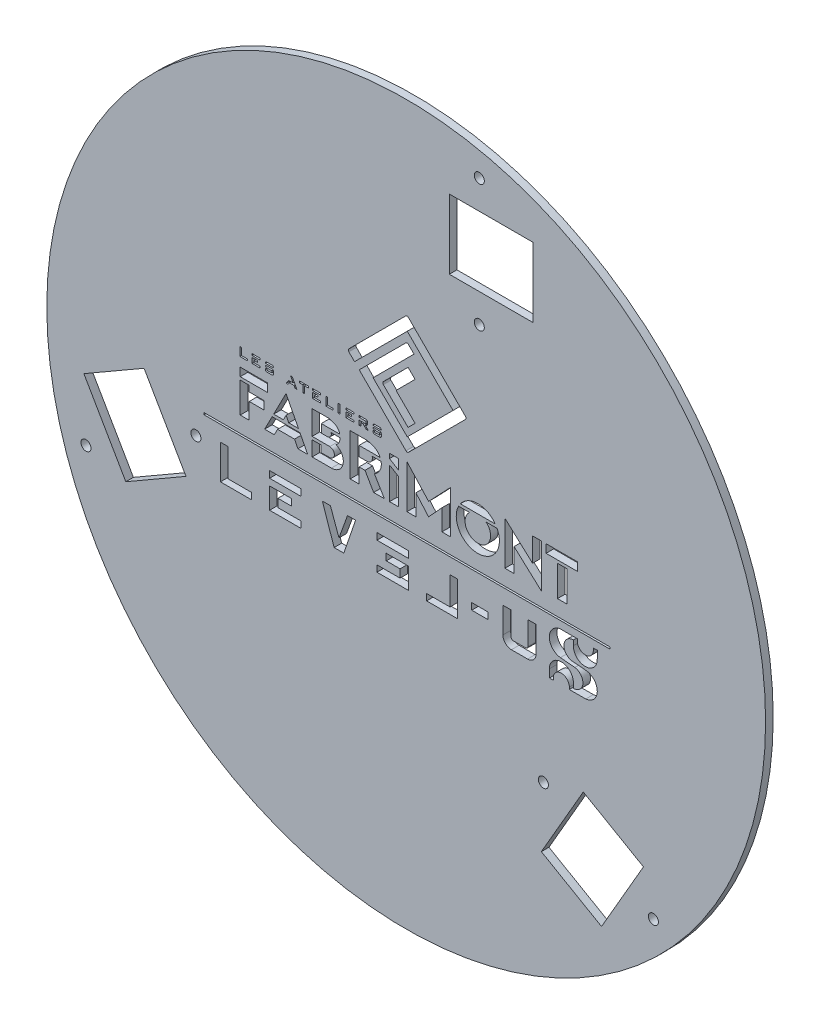
from build123d import *

# Parameters (mm, degrees)
ESQUISSE1_R        = 150
ESQUISSE1_W        = 6.731645007
ESQUISSE1_H        = 2.75786913
ESQUISSE1_W_2      = 13.090950033
ESQUISSE1_H_2      = 2.784768482
ESQUISSE1_H_3      = 2.767765773
ESQUISSE1_W_3      = 3.272737503
ESQUISSE1_H_4      = 0.69619212
ESQUISSE1_W_4      = 0.68603907
ESQUISSE1_H_5      = 3.588641098
ESQUISSE1_W_5      = 3.272737508
ESQUISSE1_W_6      = 169.389789257
ESQUISSE1_H_6      = 0.798843188
ESQUISSE1_W_7      = 3.919515326
ESQUISSE1_H_7      = 12.781823865
ESQUISSE1_W_8      = 13.187154377
ESQUISSE1_H_8      = 3.483743869
ESQUISSE1_W_9      = 35
ESQUISSE1_H_9      = 29.000000001
ESQUISSE1_W_10     = 11.390112932
BOSS_EXTRU_1_DEPTH = 3.175


with BuildPart() as part:
    # Esquisse1 → Boss.-Extru.1 (new body)
    with BuildSketch(Plane.XY):
        with Locations((61.36797308, 63.927277379)):
            Circle(ESQUISSE1_R)
        with BuildLine():
            Line((39.802839293, 108.269167166), (61.81799605, 130.287151309))
            Line((61.81799605, 130.287151309), (80.91486918, 111.192730463))
            Line((80.91486918, 111.192730463), (61.81799605, 92.093404735))
            Line((61.81799605, 92.093404735), (47.562765531, 106.346804707))
            Line((47.562765531, 106.346804707), (64.625312717, 123.411543226))
            Line((64.625312717, 123.411543226), (62.280325644, 125.756229172))
            ThreePointArc((62.280325644, 125.756229172), (61.741495947, 125.979379207), (61.202694911, 125.756159977))
            Line((61.202694911, 125.756159977), (41.760644867, 106.311613001))
            Line((41.760644867, 106.311613001), (61.279146092, 86.795618198))
            ThreePointArc((61.279146092, 86.795618198), (61.817975789, 86.572468163), (62.356776825, 86.795687393))
            Line((62.356776825, 86.795687393), (86.117475765, 110.559437904))
            ThreePointArc((86.117475765, 110.559437904), (86.3406258, 111.098267601), (86.11740657, 111.637068637))
            Line((86.11740657, 111.637068637), (62.256010971, 135.495400128))
            ThreePointArc((62.256010971, 135.495400128), (61.717181274, 135.718550163), (61.178380238, 135.495330933))
            Line((61.178380238, 135.495330933), (37.4176813, 111.731580422))
            ThreePointArc((37.4176813, 111.731580422), (37.194531265, 111.192750725), (37.417750495, 110.653949689))
            Line((37.417750495, 110.653949689), (39.802839293, 108.269167166))
        make_face(mode=Mode.SUBTRACT)
        with Locations((92.073197029, 44.27738818)):
            Rectangle(ESQUISSE1_W, ESQUISSE1_H, mode=Mode.SUBTRACT)
        Polygon((69.901655778, 36.855773092), (69.901655778, 39.537154958), (79.656520536, 39.537154958), (79.656520536, 51.210337484), (82.771025539, 51.210337484), (82.771025539, 36.855773092), align=None, mode=Mode.SUBTRACT)
        with Locations((55.695543851, 49.817953243)):
            Rectangle(ESQUISSE1_W_2, ESQUISSE1_H_2, mode=Mode.SUBTRACT)
        with Locations((10.917026814, 49.809451889)):
            Rectangle(ESQUISSE1_W_2, ESQUISSE1_H_3, mode=Mode.SUBTRACT)
        Polygon((4.371551797, 36.855773092), (17.46250183, 36.855773092), (17.46250183, 39.529083204), (7.814510337, 39.529083204), (7.814510337, 42.898453615), (13.576494708, 42.898453615), (13.576494708, 45.656322745), (4.371551797, 45.656322745), align=None, mode=Mode.SUBTRACT)
        with BuildLine():
            Line((48.211767281, 89.823698357), (50.304602867, 89.823698357))
            ThreePointArc((50.304602867, 89.823698357), (50.789536698, 89.622832188), (50.990402867, 89.137898357))
            Line((50.990402867, 89.137898357), (50.990402867, 89.127506237))
            Line((50.990402867, 89.127506237), (47.525967281, 89.127506237))
            Line((47.525967281, 89.127506237), (47.525967281, 89.137898357))
            ThreePointArc((47.525967281, 89.137898357), (47.726833451, 89.622832188), (48.211767281, 89.823698357))
        make_face(mode=Mode.SUBTRACT)
        with Locations((37.887114092, 89.475602297)):
            Rectangle(ESQUISSE1_W_3, ESQUISSE1_H_4, mode=Mode.SUBTRACT)
        Polygon((27.796169423, 86.235057259), (30.900653633, 86.235057259), (30.900653633, 86.905402726), (28.47527121, 86.905402726), (28.47527121, 89.823698357), (27.796169423, 89.823698357), align=None, mode=Mode.SUBTRACT)
        with Locations((33.301790388, 88.029377808)):
            Rectangle(ESQUISSE1_W_4, ESQUISSE1_H_5, mode=Mode.SUBTRACT)
        Polygon((24.567229374, 88.435194673), (24.567229374, 87.74572739), (23.126733276, 87.74572739), (23.126733276, 86.905402726), (25.538731149, 86.905402726), (25.538731149, 86.235057259), (22.265993646, 86.235057259), (22.265993646, 88.435194673), align=None, mode=Mode.SUBTRACT)
        with Locations((23.902362397, 89.475602297)):
            Rectangle(ESQUISSE1_W_3, ESQUISSE1_H_4, mode=Mode.SUBTRACT)
        Polygon((-2.063598746, 87.74572739), (-0.623102654, 87.74572739), (-0.623102654, 88.435194673), (-2.924338381, 88.435194673), (-2.924338381, 86.235057259), (0.348399127, 86.235057259), (0.348399127, 86.903384787), (-2.063598746, 86.903384787), align=None, mode=Mode.SUBTRACT)
        with Locations((-1.287969627, 89.475602297)):
            Rectangle(ESQUISSE1_W_5, ESQUISSE1_H_4, mode=Mode.SUBTRACT)
        with BuildLine():
            Line((62.1431773, 95.688579322), (51.821807028, 105.99122113))
            ThreePointArc((51.821807028, 105.99122113), (51.598133194, 106.529833604), (51.820828443, 107.068851421))
            Line((51.820828443, 107.068851421), (62.152684002, 117.41948855))
            Line((62.152684002, 117.41948855), (65.072494185, 114.504976452))
            Line((65.072494185, 114.504976452), (57.143290201, 106.561358512))
            Line((57.143290201, 106.561358512), (65.077465747, 98.628201815))
            Line((65.077465747, 98.628201815), (62.1431773, 95.688579322))
        make_face(mode=Mode.SUBTRACT)
        with BuildLine():
            Line((3.262887837, 86.235057259), (5.355723423, 86.235057259))
            ThreePointArc((5.355723423, 86.235057259), (5.840657253, 86.435923429), (6.041523423, 86.920857259))
            Line((6.041523423, 86.920857259), (6.041523423, 87.749394673))
            ThreePointArc((6.041523423, 87.749394673), (5.840657253, 88.234328503), (5.355723423, 88.435194673))
            Line((5.355723423, 88.435194673), (2.577087837, 88.435194673))
            Line((2.577087837, 88.435194673), (2.577087837, 88.43152739))
            ThreePointArc((2.577087837, 88.43152739), (2.777954007, 87.94659356), (3.262887837, 87.74572739))
            Line((3.262887837, 87.74572739), (5.355723423, 87.74572739))
            Line((5.355723423, 87.74572739), (5.355723423, 86.903384787))
            Line((5.355723423, 86.903384787), (3.265274203, 86.903384787))
            Line((3.265274203, 86.903384787), (3.265274203, 87.335125966))
            Line((3.265274203, 87.335125966), (2.577087837, 87.335125966))
            Line((2.577087837, 87.335125966), (2.577087837, 86.920857259))
            ThreePointArc((2.577087837, 86.920857259), (2.777954007, 86.435923429), (3.262887837, 86.235057259))
        make_face(mode=Mode.SUBTRACT)
        Polygon((20.555865077, 89.823698357), (20.555865077, 89.127506237), (18.976351066, 89.127506237), (18.976351066, 86.235057259), (18.299416489, 86.235057259), (18.299416489, 89.127506237), (16.75213746, 89.127506237), (16.75213746, 89.823698357), align=None, mode=Mode.SUBTRACT)
        Polygon((54.413662345, 80.560288355), (58.180772499, 78.240299787), (58.180772499, 82.461845497), (54.413662345, 82.461845497), align=None, mode=Mode.SUBTRACT)
        Polygon((65.419897925, 73.69954547), (65.419897925, 64.985615003), (61.688677848, 64.985615003), (61.688677848, 83.085586418), (70.71969971, 73.233223817), (79.887417285, 82.861342833), (79.887417285, 64.985615003), (76.26725655, 64.985615003), (76.26725655, 73.69954547), (70.711083949, 67.630728093), align=None, mode=Mode.SUBTRACT)
        with BuildLine():
            Line((94.70698494, 77.767438868), (99.306437795, 77.76743887))
            ThreePointArc((99.306437795, 77.76743887), (91.264316644, 64.687139066), (83.222195495, 77.767438871))
            Line((83.222195495, 77.767438871), (87.821648353, 77.767438871))
            ThreePointArc((87.821648353, 77.767438871), (91.264316642, 68.370406553), (94.70698494, 77.767438868))
        make_face(mode=Mode.SUBTRACT)
        with Locations((61.688677848, 58.078374284)):
            Rectangle(ESQUISSE1_W_6, ESQUISSE1_H_6, mode=Mode.SUBTRACT)
        with Locations((126.463931221, 71.376526936)):
            Rectangle(ESQUISSE1_W_7, ESQUISSE1_H_7, mode=Mode.SUBTRACT)
        with Locations((126.335722776, 80.719973563)):
            Rectangle(ESQUISSE1_W_8, ESQUISSE1_H_8, mode=Mode.SUBTRACT)
        Polygon((11.226870065, 82.461845497), (16.408068461, 72.429139451), (12.352859213, 72.429139451), (11.226870065, 74.609468649), (10.102676794, 72.429139451), (6.053935346, 72.429139451), align=None, mode=Mode.SUBTRACT)
        Polygon((2.015702569, 71.911784275), (-4.161148262, 71.911784275), (-4.161148262, 65.118728722), (-7.916673568, 65.118728722), (-7.916673568, 77.767438868), (-4.161148262, 77.767438868), (-4.161148262, 75.346113337), (2.015702569, 75.346113337), align=None, mode=Mode.SUBTRACT)
        with BuildLine():
            Line((47.525967281, 88.435194673), (50.304602867, 88.435194673))
            ThreePointArc((50.304602867, 88.435194673), (50.789536698, 88.234328503), (50.990402867, 87.749394673))
            Line((50.990402867, 87.749394673), (50.990402867, 86.920857259))
            ThreePointArc((50.990402867, 86.920857259), (50.789536698, 86.435923429), (50.304602867, 86.235057259))
            Line((50.304602867, 86.235057259), (48.211767281, 86.235057259))
            ThreePointArc((48.211767281, 86.235057259), (47.726833451, 86.435923429), (47.525967281, 86.920857259))
            Line((47.525967281, 86.920857259), (47.525967281, 87.335125966))
            Line((47.525967281, 87.335125966), (48.214153647, 87.335125966))
            Line((48.214153647, 87.335125966), (48.214153647, 86.903384787))
            Line((48.214153647, 86.903384787), (50.304602867, 86.903384787))
            Line((50.304602867, 86.903384787), (50.304602867, 87.74572739))
            Line((50.304602867, 87.74572739), (48.211767281, 87.74572739))
            ThreePointArc((48.211767281, 87.74572739), (47.726833451, 87.94659356), (47.525967281, 88.43152739))
            Line((47.525967281, 88.43152739), (47.525967281, 88.435194673))
        make_face(mode=Mode.SUBTRACT)
        Polygon((2.284635488, 65.118728722), (6.333376936, 65.118728722), (7.699586767, 67.768439643), (14.75978814, 67.768439643), (16.196924489, 64.985615003), (20.252133737, 64.985615003), (17.042553267, 71.200543468), (5.420462501, 71.200543468), align=None, mode=Mode.SUBTRACT)
        with BuildLine():
            Line((25.931121817, 78.978151272), (33.679652067, 78.978151272))
            ThreePointArc((33.679652067, 78.978151272), (32.636361178, 80.836726211), (30.831013962, 81.969633142))
            Line((30.831013962, 81.969633142), (29.299421409, 82.461897174))
            Line((29.299421409, 82.461897174), (22.104939054, 82.461897174))
            Line((22.104939054, 82.461897174), (22.104939054, 72.429191128))
            Line((22.104939054, 72.429191128), (29.478101938, 72.429191128))
            ThreePointArc((29.478101938, 72.429191128), (31.381420303, 70.383845554), (29.382277758, 68.432054479))
            Line((29.382277758, 68.432054479), (25.903848357, 68.432054479))
            Line((25.903848357, 68.432054479), (25.903848357, 71.200593541))
            Line((25.903848357, 71.200593541), (22.10493854, 71.200593541))
            Line((22.10493854, 71.200593541), (22.10493854, 64.985665077))
            Line((22.10493854, 64.985665077), (30.150302927, 64.985665077))
            ThreePointArc((30.150302927, 64.985665077), (35.024826758, 68.891898978), (32.124130417, 74.424132396))
            ThreePointArc((32.124130417, 74.424132396), (33.357268206, 75.901267801), (33.826071418, 77.767488946))
            Line((33.826071418, 77.767488946), (30.031138101, 77.767488946))
            ThreePointArc((30.031138101, 77.767488946), (29.865542187, 76.314133341), (28.648760776, 75.50227897))
            Line((28.648760776, 75.50227897), (25.931121817, 75.50227897))
            Line((25.931121817, 75.50227897), (25.931121817, 78.978151272))
        make_face(mode=Mode.SUBTRACT)
        with BuildLine():
            Line((41.705376449, 78.978101628), (50.492445064, 78.978101628))
            ThreePointArc((50.492445064, 78.978101628), (49.130418898, 80.806383582), (47.135350374, 81.909756484))
            Line((47.135350374, 81.909756484), (45.197958272, 82.461845494))
            Line((45.197958272, 82.461845494), (37.979606095, 82.461845494))
            Line((37.979606095, 82.461845494), (37.979606095, 64.985615001))
            Line((37.979606095, 64.985615001), (41.705376443, 64.985615001))
            Line((41.705376443, 64.985615001), (41.705376443, 71.20054347))
            Line((41.705376443, 71.20054347), (44.172281433, 71.20054347))
            Line((44.172281433, 71.20054347), (47.779334986, 64.985615006))
            Line((47.779334986, 64.985615006), (52.244221108, 64.985615006))
            Line((52.244221108, 64.985615006), (48.067087332, 71.945483309))
            ThreePointArc((48.067087332, 71.945483309), (50.440954942, 74.389058751), (50.879786747, 77.767480723))
            Line((50.879786747, 77.767480723), (47.135350382, 77.767480723))
            ThreePointArc((47.135350382, 77.767480723), (46.830496996, 75.76709939), (45.029358803, 74.844948494))
            Line((45.029358803, 74.844948494), (41.705376449, 74.844948494))
            Line((41.705376449, 74.844948494), (41.705376449, 78.978101628))
        make_face(mode=Mode.SUBTRACT)
        Polygon((-73.14983017, 47.462515996), (-55.64983017, 17.151626863), (-30.53509346, 31.651626864), (-48.03509346, 61.962515996), align=None, mode=Mode.SUBTRACT)
        Polygon((135.271039621, 0.474712328), (117.77103962, -29.836176806), (142.88577633, -44.336176805), (160.38577633, -14.025287672), align=None, mode=Mode.SUBTRACT)
        with Locations((96.867973079, 174.155492946)):
            Rectangle(ESQUISSE1_W_9, ESQUISSE1_H_9, mode=Mode.SUBTRACT)
        Polygon((54.413662345, 64.985615003), (58.180772499, 64.985615003), (58.180772499, 75.943449648), (54.413662345, 78.240299787), align=None, mode=Mode.SUBTRACT)
        with Locations((-2.221617102, 80.719973563)):
            Rectangle(ESQUISSE1_W_10, ESQUISSE1_H_8, mode=Mode.SUBTRACT)
        Polygon((102.546069037, 64.985615003), (106.395567469, 64.985615003), (106.395567469, 74.748202671), (117.876321231, 64.274813621), (117.876321231, 82.461845497), (114.108016047, 82.461845497), (114.108016047, 72.557198641), (102.546069037, 83.085586418), align=None, mode=Mode.SUBTRACT)
        with BuildLine():
            Line((83.959502194, 78.978101631), (98.569131095, 78.978101631))
            ThreePointArc((98.569131095, 78.978101631), (91.264316645, 82.711951882), (83.959502194, 78.978101631))
        make_face(mode=Mode.SUBTRACT)
        Polygon((14.534774041, 87.06405329), (14.95965948, 86.235057259), (15.748291614, 86.235057259), (13.805346508, 89.823698357), (13.120372811, 89.823698357), (14.185395527, 87.74572739), (12.281449515, 87.74572739), (11.342159502, 86.235057259), (12.077748069, 86.235057259), (12.562837741, 87.06405329), align=None, mode=Mode.SUBTRACT)
        with BuildLine():
            Line((3.262887838, 89.823698359), (5.355723424, 89.823698359))
            ThreePointArc((5.355723424, 89.823698359), (5.844368724, 89.619172045), (6.041523423, 89.127506237))
            Line((6.041523423, 89.127506237), (2.577087838, 89.127506237))
            Line((2.577087838, 89.127506237), (2.577087838, 89.137898359))
            ThreePointArc((2.577087838, 89.137898359), (2.777954008, 89.622832189), (3.262887838, 89.823698359))
        make_face(mode=Mode.SUBTRACT)
        Polygon((-7.278213798, 89.823698357), (-8.056840049, 89.823698357), (-8.056840049, 86.235057259), (-4.839497609, 86.235057259), (-4.839497609, 86.905402726), (-7.278213798, 86.905402726), align=None, mode=Mode.SUBTRACT)
        Polygon((36.250745341, 86.235057259), (39.523482844, 86.235057259), (39.523482844, 86.905402726), (37.111484971, 86.905402726), (37.111484971, 87.74572739), (38.551981069, 87.74572739), (38.551981069, 88.435194673), (36.250745341, 88.435194673), align=None, mode=Mode.SUBTRACT)
        with BuildLine():
            Line((45.174159371, 89.137898357), (45.174159371, 88.268809996))
            ThreePointArc((45.174159371, 88.268809996), (44.973293202, 87.783876166), (44.488359371, 87.583009996))
            Line((44.488359371, 87.583009996), (44.201145239, 87.583009996))
            Line((44.201145239, 87.583009996), (45.608703526, 86.235057259))
            Line((45.608703526, 86.235057259), (44.664190191, 86.235057259))
            Line((44.664190191, 86.235057259), (43.363074891, 87.573372104))
            Line((43.363074891, 87.573372104), (42.563129922, 87.573372104))
            Line((42.563129922, 87.573372104), (42.563129922, 86.235057259))
            Line((42.563129922, 86.235057259), (41.767526154, 86.235057259))
            Line((41.767526154, 86.235057259), (41.767526154, 88.103456113))
            Line((41.767526154, 88.103456113), (44.509983936, 88.103456113))
            Line((44.509983936, 88.103456113), (44.509983936, 89.127506237))
            Line((44.509983936, 89.127506237), (41.767526154, 89.127506237))
            Line((41.767526154, 89.127506237), (41.767526154, 89.823698357))
            Line((41.767526154, 89.823698357), (44.488359371, 89.823698357))
            ThreePointArc((44.488359371, 89.823698357), (44.973293202, 89.622832188), (45.174159371, 89.137898357))
        make_face(mode=Mode.SUBTRACT)
        Polygon((31.281701538, 36.838770383), (35.330554146, 36.838770383), (40.234999013, 51.193334775), (36.874430896, 51.193334775), (33.306127842, 41.323760026), (29.737824788, 51.193334775), (26.37725667, 51.193334775), align=None, mode=Mode.SUBTRACT)
        Polygon((-3.289085114, 39.537154958), (-13.043949872, 39.537154958), (-13.043949872, 51.210337484), (-16.158454875, 51.210337484), (-16.158454875, 36.855773092), (-3.289085114, 36.855773092), align=None, mode=Mode.SUBTRACT)
        Polygon((49.150068834, 39.529083204), (49.150068834, 36.855773092), (62.241018867, 36.855773092), (62.241018867, 45.656322745), (53.036075956, 45.656322745), (53.036075956, 42.898453615), (58.798060328, 42.898453615), (58.798060328, 39.529083204), align=None, mode=Mode.SUBTRACT)
        with BuildLine():
            Line((115.579630549, 40.467394149), (115.579630549, 51.210337484))
            Line((115.579630549, 51.210337484), (112.219062431, 51.210337484))
            Line((112.219062431, 51.210337484), (112.219062431, 41.537383475))
            ThreePointArc((112.219062431, 41.537383475), (111.921482921, 40.818962985), (111.203062431, 40.521383475))
            Line((111.203062431, 40.521383475), (106.098456324, 40.521383475))
            ThreePointArc((106.098456324, 40.521383475), (105.380035834, 40.818962985), (105.082456324, 41.537383475))
            Line((105.082456324, 41.537383475), (105.082456324, 51.210337484))
            Line((105.082456324, 51.210337484), (101.721888206, 51.210337484))
            Line((101.721888206, 51.210337484), (101.721888206, 40.467394149))
            ThreePointArc((101.721888206, 40.467394149), (102.763416492, 37.952922435), (105.277888206, 36.911394149))
            Line((105.277888206, 36.911394149), (112.023630549, 36.911394149))
            ThreePointArc((112.023630549, 36.911394149), (114.538102263, 37.952922435), (115.579630549, 40.467394149))
        make_face(mode=Mode.SUBTRACT)
        with BuildLine():
            Line((121.148867386, 34.608724612), (121.119708298, 37.924508877))
            ThreePointArc((121.119708298, 37.924508877), (126.134593438, 42.93939402), (131.149478579, 37.924508877))
            Line((131.149478579, 37.924508877), (131.126267543, 35.875092186))
            ThreePointArc((131.126267543, 35.875092186), (135.114339451, 39.50974119), (131.754835867, 43.732196233))
            Line((131.754835867, 43.732196233), (125.699924923, 44.267244624))
            ThreePointArc((125.699924923, 44.267244624), (121.091960122, 49.446062696), (125.699924924, 54.624880767))
            Line((125.699924924, 54.624880767), (132.775339521, 54.624880767))
            Line((132.775339521, 54.624880767), (132.775339521, 53.784001077))
            ThreePointArc((132.775339521, 53.784001077), (136.117321809, 50.442018788), (139.459304098, 53.784001077))
            Line((139.459304098, 53.784001077), (139.459304098, 54.624880767))
            Line((139.459304098, 54.624880767), (141.149095415, 54.624880767))
            Line((141.149095415, 54.624880767), (141.099370881, 51.248444207))
            ThreePointArc((141.099370881, 51.248444207), (136.107925294, 46.256998614), (131.116479704, 51.248444205))
            Line((131.116479704, 51.248444205), (131.126267541, 53.364207604))
            ThreePointArc((131.126267541, 53.364207604), (127.221743897, 49.668005516), (130.557467657, 45.451352606))
            Line((130.557467657, 45.451352606), (136.117321805, 45.007706412))
            ThreePointArc((136.117321805, 45.007706412), (141.112105155, 39.899757613), (136.311691482, 34.608724612))
            Line((136.311691482, 34.608724612), (129.460403498, 34.608724612))
            Line((129.460403498, 34.608724612), (129.460403498, 35.471151762))
            ThreePointArc((129.460403498, 35.471151762), (126.10933113, 38.82222413), (122.758258762, 35.471151762))
            Line((122.758258762, 35.471151762), (122.758258762, 34.608724612))
            Line((122.758258762, 34.608724612), (121.148867386, 34.608724612))
        make_face(mode=Mode.SUBTRACT)
        with BuildLine():
            ThreePointArc((-24.292788615, 48.476944411), (-26.392788615, 50.576944411), (-28.492788615, 48.476944411))
            ThreePointArc((-28.492788615, 48.476944411), (-26.392788615, 46.376944411), (-24.292788615, 48.476944411))
        make_face(mode=Mode.SUBTRACT)
        with BuildLine():
            ThreePointArc((-70.192135015, 21.976944412), (-72.292135015, 24.076944412), (-74.392135015, 21.976944412))
            ThreePointArc((-74.392135015, 21.976944412), (-72.292135015, 19.876944412), (-70.192135015, 21.976944412))
        make_face(mode=Mode.SUBTRACT)
        with BuildLine():
            ThreePointArc((120.728734773, -4.350605219), (118.628734773, -2.250605219), (116.528734773, -4.350605219))
            ThreePointArc((116.528734773, -4.350605219), (118.628734773, -6.450605219), (120.728734773, -4.350605219))
        make_face(mode=Mode.SUBTRACT)
        with BuildLine():
            ThreePointArc((166.628081173, -30.850605219), (164.528081173, -28.750605219), (162.428081173, -30.850605219))
            ThreePointArc((162.428081173, -30.850605219), (164.528081173, -32.950605219), (166.628081173, -30.850605219))
        make_face(mode=Mode.SUBTRACT)
        with BuildLine():
            ThreePointArc((89.76797308, 147.655492945), (91.86797308, 145.555492945), (93.96797308, 147.655492945))
            ThreePointArc((93.96797308, 147.655492945), (91.86797308, 149.755492945), (89.76797308, 147.655492945))
        make_face(mode=Mode.SUBTRACT)
        with BuildLine():
            ThreePointArc((93.96797308, 200.655492947), (91.86797308, 202.755492947), (89.76797308, 200.655492947))
            ThreePointArc((89.76797308, 200.655492947), (91.86797308, 198.555492947), (93.96797308, 200.655492947))
        make_face(mode=Mode.SUBTRACT)
    extrude(amount=BOSS_EXTRU_1_DEPTH)


solid = part.part
